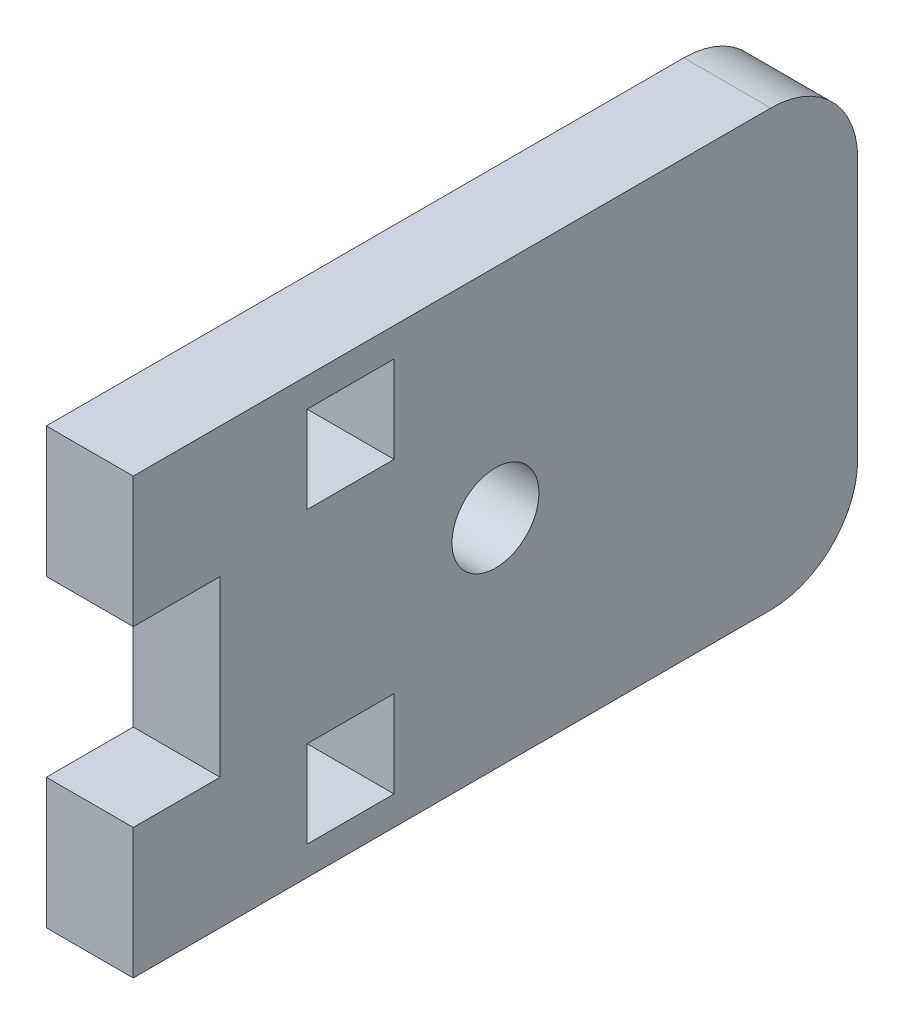
from build123d import *

# Parameters (mm, degrees)
SKETCH1_R           = 1.5
BOSS_EXTRUDE1_DEPTH = 3
SKETCH2_W           = 3
SKETCH2_H           = 3
CUT_EXTRUDE1_DEPTH  = 3
FILLET1_R           = 3


with BuildPart() as part:
    # Sketch1 → Boss-Extrude1 (new body)
    with BuildSketch(Plane(origin=(0, 0, 0), x_dir=(0, 0, -1), z_dir=(1, 0, 0))):
        Polygon((-12.5, -7.5), (-12.5, -3), (-9.5, -3), (-9.5, 3), (-12.5, 3), (-12.5, 7.5), (12.5, 7.5), (12.5, -7.5), align=None)
        Circle(SKETCH1_R, mode=Mode.SUBTRACT)
    extrude(amount=BOSS_EXTRUDE1_DEPTH)

    # Sketch2 → Cut-Extrude1 (cut)
    with BuildSketch(Plane(origin=(3, 0, 0), x_dir=(0, 0, -1), z_dir=(1, 0, 0))):
        with Locations((-5, 5)):
            Rectangle(SKETCH2_W, SKETCH2_H)
        with Locations((-5, -5)):
            Rectangle(SKETCH2_W, SKETCH2_H)
    extrude(amount=-CUT_EXTRUDE1_DEPTH, mode=Mode.SUBTRACT)

    # Fillet1
    fillet1_edges = [part.edges().sort_by_distance(p)[0] for p in [
        (1.5, -7.5, -12.5),
        (1.5, 7.5, -12.5),
    ]]
    fillet(fillet1_edges, radius=FILLET1_R)


solid = part.part
